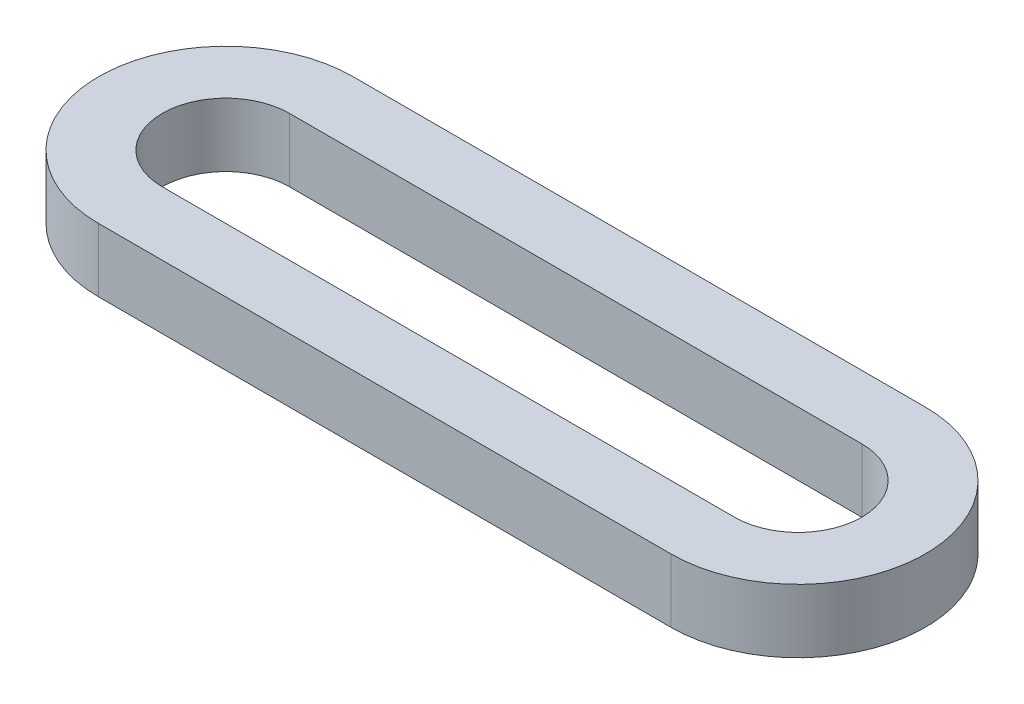
from build123d import *

# Parameters (mm, degrees)
BOSS_EXTRUDE1_DEPTH = 2


with BuildPart() as part:
    # Sketch1 → Boss-Extrude1 (new body)
    with BuildSketch(Plane(origin=(0, 0, 0), x_dir=(1, 0, 0), z_dir=(0, 1, 0))):
        with BuildLine():
            ThreePointArc((9, -4), (13, 0), (9, 4))
            Line((9, 4), (-9, 4))
            ThreePointArc((-9, 4), (-13, 0), (-9, -4))
            Line((-9, -4), (9, -4))
        make_face()
        with BuildLine():
            Line((-9, 2), (9, 2))
            ThreePointArc((9, 2), (11, 0), (9, -2))
            Line((9, -2), (-9, -2))
            ThreePointArc((-9, -2), (-11, 0), (-9, 2))
        make_face(mode=Mode.SUBTRACT)
    extrude(amount=BOSS_EXTRUDE1_DEPTH)


solid = part.part
